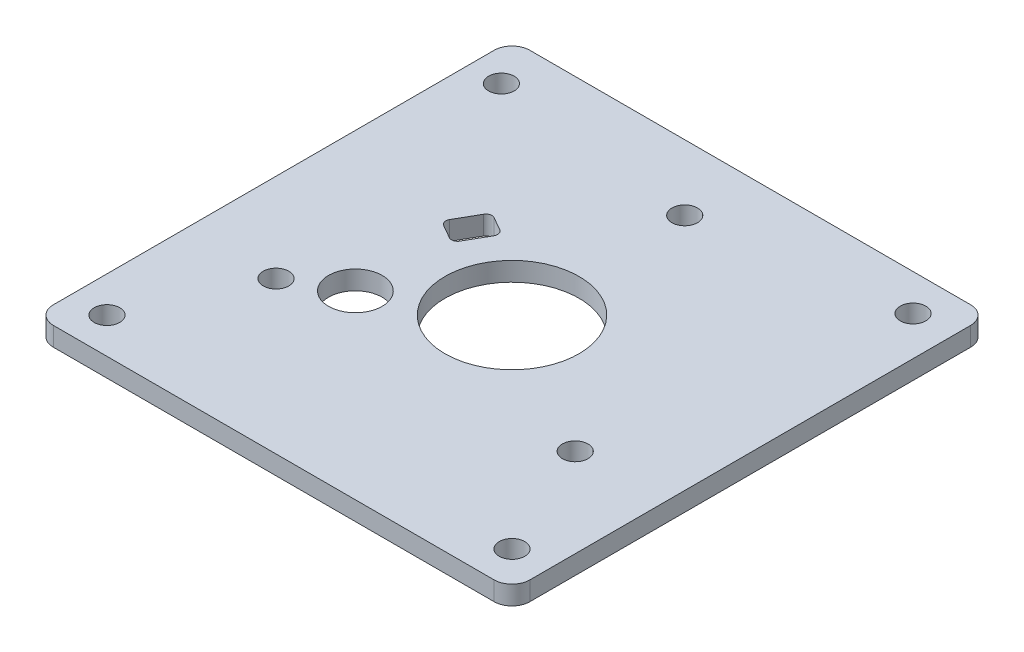
from build123d import *

# Parameters (mm, degrees)
SKETCH1_W           = 80
SKETCH1_H           = 80
SKETCH1_R           = 11.25
SKETCH1_R_2         = 2.15
SKETCH1_R_3         = 4.5
BOSS_EXTRUDE1_DEPTH = 3.175
FILLET1_R           = 3
FILLET2_R           = 1


with BuildPart() as part:
    # Sketch1 → Boss-Extrude1 (new body)
    with BuildSketch(Plane(origin=(0, 0, 0), x_dir=(1, 0, 0), z_dir=(0, 1, 0))):
        Rectangle(SKETCH1_W, SKETCH1_H)
        with Locations(Location((0, 0, 0), (0, 0, 270))):
            Circle(SKETCH1_R, mode=Mode.SUBTRACT)
        with Locations(Location((0, 29, 0), (0, 0, 270))):
            Circle(SKETCH1_R_2, mode=Mode.SUBTRACT)
        with Locations(Location((25.11473671, -14.5, 0), (0, 0, 270))):
            Circle(SKETCH1_R_2, mode=Mode.SUBTRACT)
        with Locations(Location((-25.11473671, -14.5, 0), (0, 0, 270))):
            Circle(SKETCH1_R_2, mode=Mode.SUBTRACT)
        with Locations(Location((-34, -34, 0), (0, 0, 270))):
            Circle(SKETCH1_R_2, mode=Mode.SUBTRACT)
        with Locations(Location((34, -34, 0), (0, 0, 90))):
            Circle(SKETCH1_R_2, mode=Mode.SUBTRACT)
        with Locations(Location((33.43865922, 33.896147379, 0), (0, 0, 270))):
            Circle(SKETCH1_R_2, mode=Mode.SUBTRACT)
        with Locations(Location((-34.552045293, 32.77182544, 0), (0, 0, 90))):
            Circle(SKETCH1_R_2, mode=Mode.SUBTRACT)
        with Locations(Location((-16.670989023, -9.625, 0), (0, 0, 270))):
            Circle(SKETCH1_R_3, mode=Mode.SUBTRACT)
        Polygon((-19.626238937, 7.781840133), (-15.635110011, 5.494726254), (-12.552478261, 10.874073937), (-16.543607188, 13.161187816), align=None, mode=Mode.SUBTRACT)
    extrude(amount=BOSS_EXTRUDE1_DEPTH)

    # Fillet1
    fillet1_edges = [part.edges().sort_by_distance(p)[0] for p in [
        (40, 1.5875, 40),
        (-40, 1.5875, 40),
        (-40, 1.5875, -40),
        (40, 1.5875, -40),
    ]]
    fillet(fillet1_edges, radius=FILLET1_R)

    # Fillet2
    fillet2_edges = [part.edges().sort_by_distance(p)[0] for p in [
        (-16.543607188, 1.5875, -13.161187816),
        (-19.626238937, 1.5875, -7.781840133),
        (-15.635110011, 1.5875, -5.494726254),
        (-12.552478261, 1.5875, -10.874073937),
    ]]
    fillet(fillet2_edges, radius=FILLET2_R)


solid = part.part
